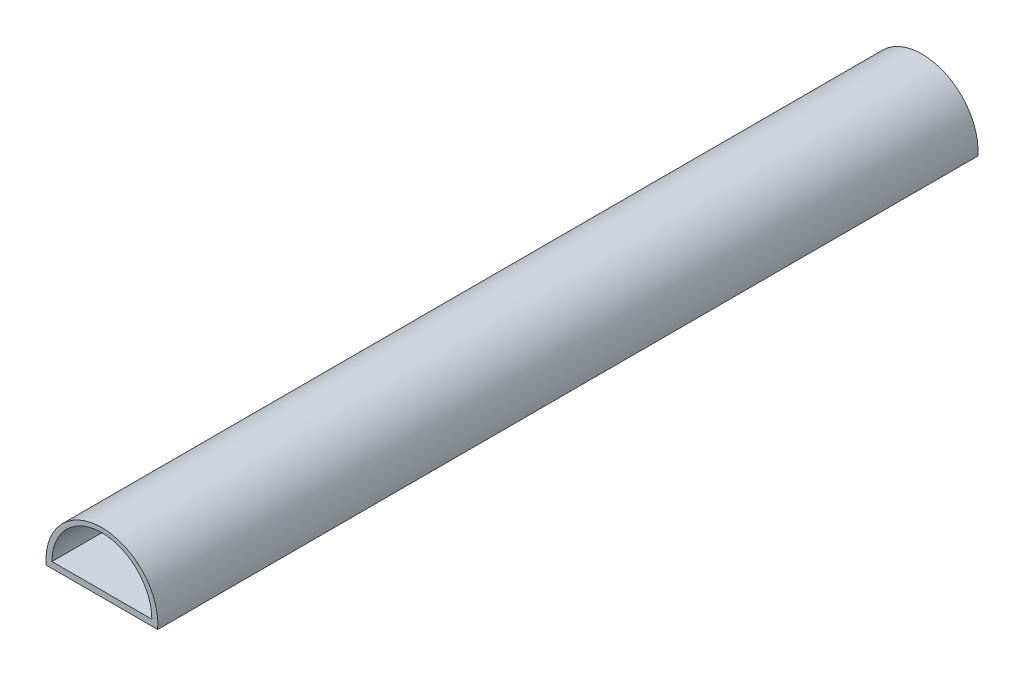
from build123d import *

# Parameters (mm, degrees)
BOSS_EXTRUDE2_DEPTH = 215.9


with BuildPart() as part:
    # Sketch1 → Boss-Extrude2 (new body)
    with BuildSketch(Plane.XY):
        with BuildLine():
            Line((-23.111377793, -10.048425127), (6.257372207, -10.048425127))
            ThreePointArc((6.257372207, -10.048425127), (-8.427002793, 5.85418124), (-23.111377793, -10.048425127))
        make_face()
        with BuildLine():
            Line((-8.427002793, -8.460925127), (-21.571502793, -8.460925127))
            ThreePointArc((-21.571502793, -8.460925127), (-8.427002793, 4.683574873), (4.717497207, -8.460925127))
            Line((4.717497207, -8.460925127), (-8.427002793, -8.460925127))
        make_face(mode=Mode.SUBTRACT)
    extrude(amount=BOSS_EXTRUDE2_DEPTH)


solid = part.part
